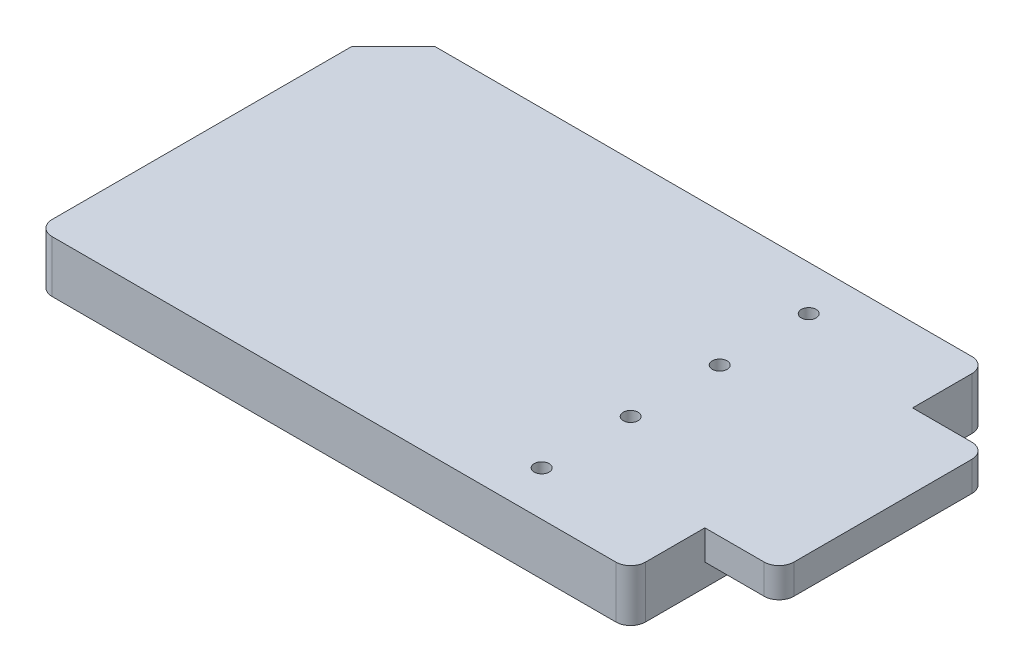
from build123d import *

# Parameters (mm, degrees)
SKETCH4_W           = 40
SKETCH4_H           = 24
BOSS_EXTRUDE2_DEPTH = 3.5
FILLET2_R           = 1
SKETCH5_W           = 4.999999906
SKETCH5_H           = 14
BOSS_EXTRUDE3_DEPTH = 2
FILLET3_R           = 1
CHAMFER1_SIZE       = 2.8
SKETCH6_R           = 1.15
CUT_EXTRUDE1_DEPTH  = 5
SKETCH8_R           = 0.6
CUT_EXTRUDE2_DEPTH  = 1.75
SKETCH9_R           = 3.5
CUT_EXTRUDE3_DEPTH  = 1.5
SKETCH10_R          = 3
CUT_EXTRUDE4_DEPTH  = 1
CUT_EXTRUDE5_DEPTH  = 0.8
SKETCH12_R          = 2.5
CUT_EXTRUDE6_DEPTH  = 1
CUT_EXTRUDE7_DEPTH  = 0.8
CUT_EXTRUDE8_DEPTH  = 0.8
SKETCH16_R          = 2.25
CUT_EXTRUDE9_DEPTH  = 1.5
CUT_EXTRUDE10_DEPTH = 0.5
SKETCH18_R          = 0.5
CUT_EXTRUDE11_DEPTH = 47.70385414
LPATTERN3_COUNT     = 4
LPATTERN3_PITCH     = 6


with BuildPart() as part:
    # Sketch4 → Boss-Extrude2 (new body)
    with BuildSketch(Plane(origin=(0, 0, 0), x_dir=(1, 0, 0), z_dir=(0, 1, 0))):
        with Locations((20, 0)):
            Rectangle(SKETCH4_W, SKETCH4_H)
    extrude(amount=BOSS_EXTRUDE2_DEPTH)

    # Fillet2
    fillet2_edges = [part.edges().sort_by_distance(p)[0] for p in [
        (40, 1.75, -12),
        (40, 1.75, 12),
        (0, 1.75, 12),
    ]]
    fillet(fillet2_edges, radius=FILLET2_R)

    # Sketch5 → Boss-Extrude3 (add)
    with BuildSketch(Plane(origin=(0, 3.5, 0), x_dir=(1, 0, 0), z_dir=(0, 1, 0))):
        with Locations((42.499999953, 0)):
            Rectangle(SKETCH5_W, SKETCH5_H)
    extrude(amount=-BOSS_EXTRUDE3_DEPTH)

    # Fillet3
    fillet3_edges = [part.edges().sort_by_distance(p)[0] for p in [
        (44.999999906, 2.5, -7),
        (44.999999906, 2.5, 7),
    ]]
    fillet(fillet3_edges, radius=FILLET3_R)

    # Chamfer1
    chamfer1_edges = [part.edges().sort_by_distance(p)[0] for p in [
        (0, 1.75, -12),
    ]]
    chamfer(chamfer1_edges, length=CHAMFER1_SIZE)

    # Sketch6 → Cut-Extrude1 (cut)
    with BuildSketch(Plane.ZY):
        with Locations((0, 1.75)):
            Circle(SKETCH6_R)
    extrude(amount=-CUT_EXTRUDE1_DEPTH, mode=Mode.SUBTRACT)

    # Sketch8 → Cut-Extrude2 (cut)
    with BuildSketch(Plane.XZ):
        with Locations(Location((5, 0, 0), (0, 0, 270))):
            Circle(SKETCH8_R)
    extrude(amount=-CUT_EXTRUDE2_DEPTH, mode=Mode.SUBTRACT)

    # Sketch9 → Cut-Extrude3 (cut)
    with BuildSketch(Plane.XZ):
        with Locations(Location((7, 0, 0), (0, 0, 270))):
            Circle(SKETCH9_R)
    extrude(amount=-CUT_EXTRUDE3_DEPTH, mode=Mode.SUBTRACT)

    # Sketch10 → Cut-Extrude4 (cut)
    with BuildSketch(Plane.XZ):
        with Locations(Location((7, -7, 0), (0, 0, 270))):
            Circle(SKETCH10_R)
    extrude(amount=-CUT_EXTRUDE4_DEPTH, mode=Mode.SUBTRACT)

    # Sketch11 → Cut-Extrude5 (cut)
    with BuildSketch(Plane(origin=(0, 0, 0), x_dir=(-1, 0, 0), z_dir=(0, -1, 0))):
        with BuildLine():
            Line((-6.5, 7), (-6.5, 3.5))
            ThreePointArc((-6.5, 3.5), (-7, 3), (-7.5, 3.5))
            Line((-7.5, 3.5), (-7.5, 7))
            ThreePointArc((-7.5, 7), (-7, 7.5), (-6.5, 7))
        make_face()
        with BuildLine():
            Line((-20, 0.5), (-7, 0.5))
            ThreePointArc((-7, 0.5), (-6.5, 0), (-7, -0.5))
            Line((-7, -0.5), (-20, -0.5))
            ThreePointArc((-20, -0.5), (-20.5, 0), (-20, 0.5))
        make_face()
    extrude(amount=-CUT_EXTRUDE5_DEPTH, mode=Mode.SUBTRACT)

    # Sketch12 → Cut-Extrude6 (cut)
    with BuildSketch(Plane.XZ):
        with Locations(Location((14, 0, 0), (0, 0, 270))):
            Circle(SKETCH12_R)
    extrude(amount=-CUT_EXTRUDE6_DEPTH, mode=Mode.SUBTRACT)

    # Sketch14 → Cut-Extrude7 (cut)
    with BuildSketch(Plane.XZ):
        with BuildLine():
            Line((19.5, -9), (19.5, 9))
            ThreePointArc((19.5, 9), (20, 9.5), (20.5, 9))
            Line((20.5, 9), (20.5, -9))
            ThreePointArc((20.5, -9), (20, -9.5), (19.5, -9))
        make_face()
    extrude(amount=-CUT_EXTRUDE7_DEPTH, mode=Mode.SUBTRACT)

    # Sketch15 → Cut-Extrude8 (cut)
    with BuildSketch(Plane.XZ):
        with BuildLine():
            Line((20, -8.5), (24, -8.5))
            ThreePointArc((24, -8.5), (24.5, -9), (24, -9.5))
            Line((24, -9.5), (20, -9.5))
            ThreePointArc((20, -9.5), (19.5, -9), (20, -8.5))
        make_face()
    cut_extrude8 = extrude(amount=-CUT_EXTRUDE8_DEPTH, mode=Mode.SUBTRACT)

    # Sketch16 → Cut-Extrude9 (cut)
    with BuildSketch(Plane.XZ):
        with Locations(Location((24, -9, 0), (0, 0, 270))):
            Circle(SKETCH16_R)
    cut_extrude9 = extrude(amount=-CUT_EXTRUDE9_DEPTH, mode=Mode.SUBTRACT)

    # Sketch17 → Cut-Extrude10 (cut)
    with BuildSketch(Plane.XZ):
        with BuildLine():
            Line((31, -9.3), (24, -9.3))
            ThreePointArc((24, -9.3), (23.7, -9), (24, -8.7))
            Line((24, -8.7), (31, -8.7))
            ThreePointArc((31, -8.7), (31.3, -9), (31, -9.3))
        make_face()
    cut_extrude10 = extrude(amount=-CUT_EXTRUDE10_DEPTH, mode=Mode.SUBTRACT)

    # Sketch18 → Cut-Extrude11 (cut, through all)
    with BuildSketch(Plane(origin=(0, 0, 0), x_dir=(-1, 0, 0), z_dir=(0, -1, 0))):
        with Locations(Location((-31, 9, 0), (0, 0, 90))):
            Circle(SKETCH18_R)
    cut_extrude11 = extrude(amount=-CUT_EXTRUDE11_DEPTH, mode=Mode.SUBTRACT)

    # LPattern3: Cut-Extrude8, Cut-Extrude9, Cut-Extrude10, Cut-Extrude11 ×4
    with Locations(*[(0, 0, i * LPATTERN3_PITCH) for i in range(1, LPATTERN3_COUNT)]):
        add(cut_extrude8, mode=Mode.SUBTRACT)
        add(cut_extrude9, mode=Mode.SUBTRACT)
        add(cut_extrude10, mode=Mode.SUBTRACT)
        add(cut_extrude11, mode=Mode.SUBTRACT)


solid = part.part
